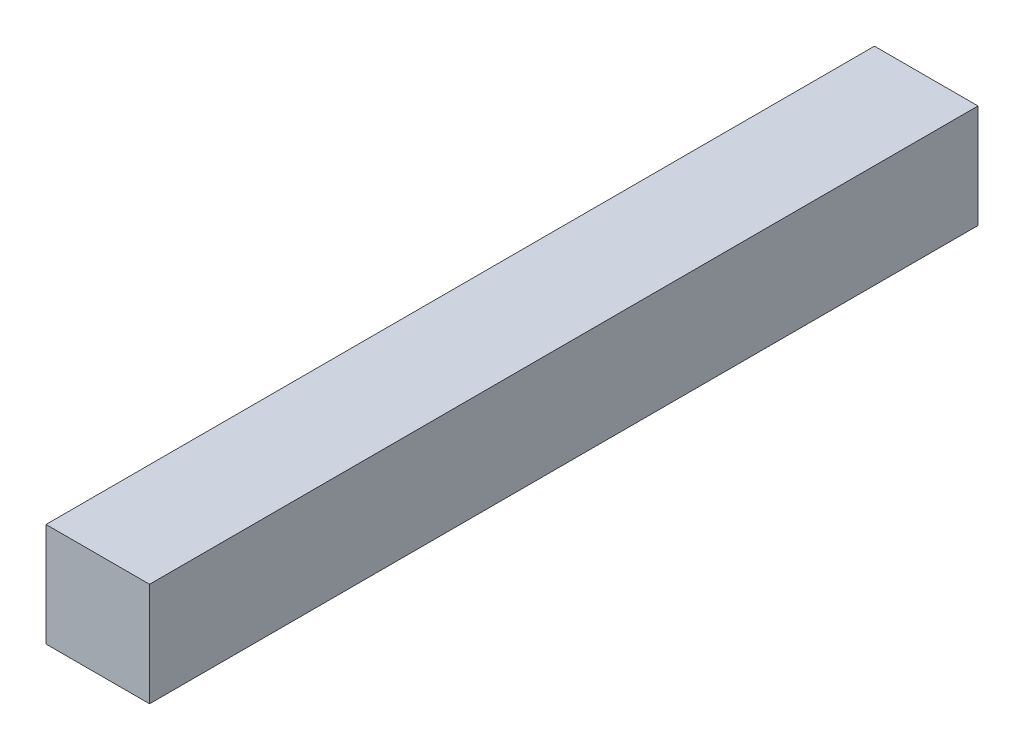
from build123d import *

# Parameters (mm, degrees)
SKETCH2_W           = 5
SKETCH2_H           = 5
BOSS_EXTRUDE1_DEPTH = 40


with BuildPart() as part:
    # Sketch2 → Boss-Extrude1 (new body)
    with BuildSketch(Plane.XY):
        with Locations((2.5, 2.5)):
            Rectangle(SKETCH2_W, SKETCH2_H)
    extrude(amount=-BOSS_EXTRUDE1_DEPTH)


solid = part.part
